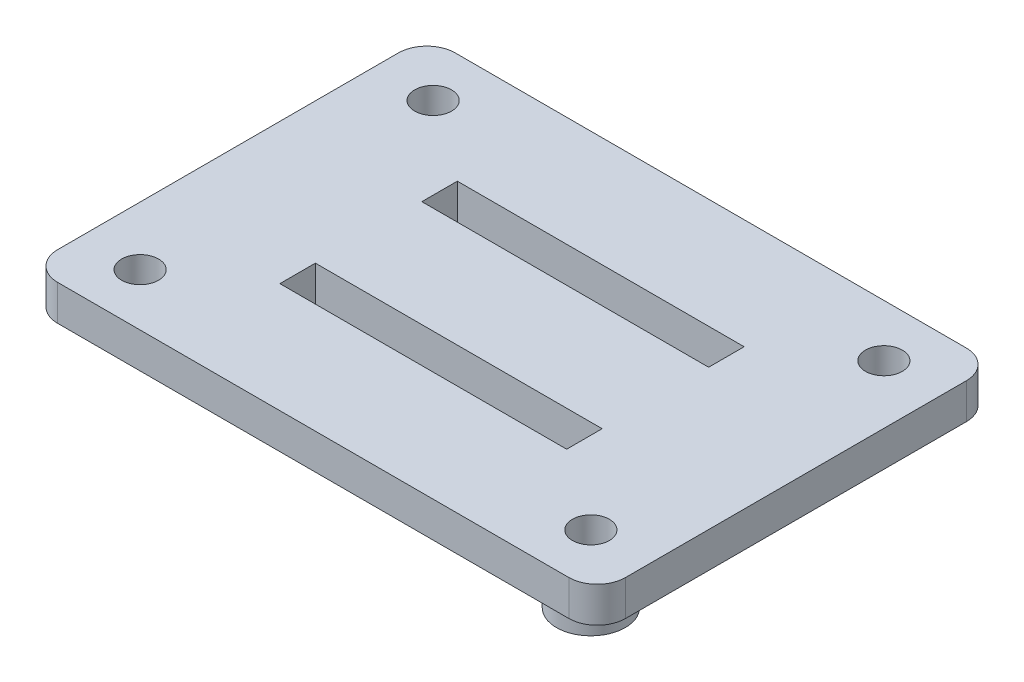
from build123d import *

# Parameters (mm, degrees)
SKETCH_3_W          = 80
SKETCH_3_H          = 56
EXTRUDE_1_DEPTH     = 5
SKETCH_1_R          = 2.6
SKETCH_1_W          = 40.4
SKETCH_1_H          = 5
CUT_EXTRUDE_1_DEPTH = 5
SKETCH_5_R          = 4.85
EXTRUDE_2_DEPTH     = 4.5
FILLET_2_R          = 4


with BuildPart() as part:
    # 草图3 → 凸台-拉伸1 (new body)
    with BuildSketch(Plane(origin=(0, 0, 0), x_dir=(1, 0, 0), z_dir=(0, 1, 0))):
        Rectangle(SKETCH_3_W, SKETCH_3_H)
    extrude(amount=EXTRUDE_1_DEPTH)

    # 草图1 → 切除-拉伸1 (cut)
    with BuildSketch(Plane(origin=(0, 0, 0), x_dir=(1, 0, 0), z_dir=(0, 1, 0))):
        with Locations(Location((-31.75, 20.6375, 0), (0, 0, 90))):
            Circle(SKETCH_1_R)
        with Locations(Location((31.75, 20.6375, 0), (0, 0, 90))):
            Circle(SKETCH_1_R)
        with Locations(Location((31.75, -20.6375, 0), (0, 0, 90))):
            Circle(SKETCH_1_R)
        with Locations(Location((-31.75, -20.6375, 0), (0, 0, 90))):
            Circle(SKETCH_1_R)
        with Locations((0, -10)):
            Rectangle(SKETCH_1_W, SKETCH_1_H)
        with Locations((0, 10)):
            Rectangle(SKETCH_1_W, SKETCH_1_H)
    extrude(amount=CUT_EXTRUDE_1_DEPTH, mode=Mode.SUBTRACT)

    # 草图5 → 凸台-拉伸2 (add)
    with BuildSketch(Plane.XZ):
        with Locations(Location((31.75, 20.6375, 0), (0, 0, 270))):
            Circle(SKETCH_5_R)
    extrude(amount=EXTRUDE_2_DEPTH)

    # 圆角2
    fillet_2_edges = [part.edges().sort_by_distance(p)[0] for p in [
        (40, 2.5, 28),
        (-40, 2.5, 28),
        (-40, 2.5, -28),
        (40, 2.5, -28),
    ]]
    fillet(fillet_2_edges, radius=FILLET_2_R)


solid = part.part
